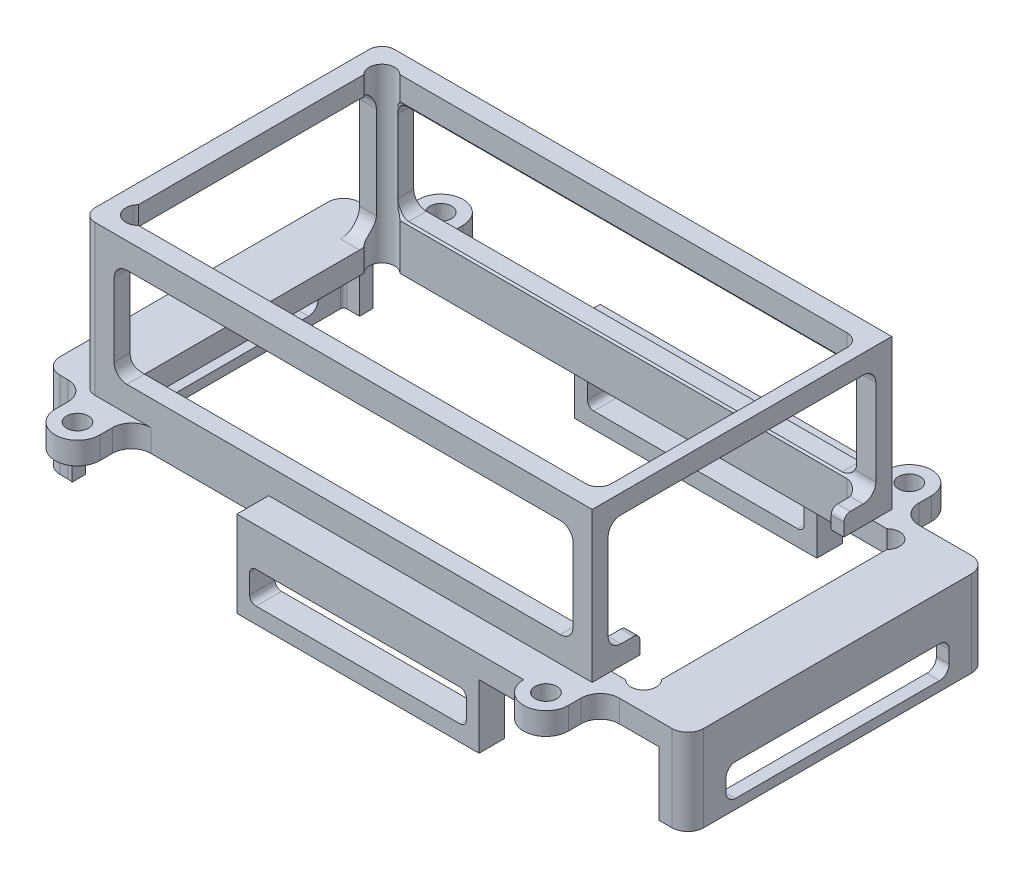
from build123d import *

# Parameters (mm, degrees)
EXTRUDE_1_DEPTH     = 23.5
EXTRUDE_START       = 3.5
SKETCH_2_R          = 1.7
EXTRUDE_2_DEPTH     = 3.5
FILLET_1_R          = 2.5
EXTRUDE_1_2_DEPTH   = 10
CUT_EXTRUDE_1_REACH = 104.962
CUT_EXTRUDE_2_REACH = 83.594
CUT_EXTRUDE_3_REACH = 96.722
CUT_EXTRUDE_4_DEPTH = 3.5
CUT_EXTRUDE_5_REACH = 108.664
SKETCH_9_W          = 45
SKETCH_9_H          = 3.5
EXTRUDE_3_DEPTH     = 5
SKETCH_10_W         = 45
SKETCH_10_H         = 3.5
EXTRUDE_4_DEPTH     = 5
SKETCH_11_W         = 38
SKETCH_11_H         = 4
EXTRUDE_5_DEPTH     = 10
CUT_EXTRUDE_6_REACH = 87.073
FILLET_3_R          = 3


with BuildPart() as part:
    # 草图1 → Extrude 1 (new body)
    with BuildSketch(Plane(origin=(0, 0, 0), x_dir=(1, 0, 0), z_dir=(0, 1, 0))):
        with BuildLine():
            Line((-38, 23.5), (40, 23.5))
            Line((40, 23.5), (40, -23.5))
            Line((40, -23.5), (-38, -23.5))
            ThreePointArc((-38, -23.5), (-39.414213562, -22.914213562), (-40, -21.5))
            Line((-40, -21.5), (-40, 21.5))
            ThreePointArc((-40, 21.5), (-39.414213562, 22.914213562), (-38, 23.5))
        make_face()
        with BuildLine():
            Line((-34.171572875, -20.5), (36, -20.5))
            ThreePointArc((36, -20.5), (37.414213562, -19.914213562), (38, -18.5))
            Line((38, -18.5), (38, 18.5))
            ThreePointArc((38, 18.5), (37.414213562, 19.914213562), (36, 20.5))
            Line((36, 20.5), (-34.171572875, 20.5))
            ThreePointArc((-34.171572875, 20.5), (-37, 20.5), (-37, 17.671572875))
            Line((-37, 17.671572875), (-37, -17.671572875))
            ThreePointArc((-37, -17.671572875), (-37, -20.5), (-34.171572875, -20.5))
        make_face(mode=Mode.SUBTRACT)
    extrude(amount=EXTRUDE_1_DEPTH)

    # 草图2 → 凸台-拉伸2 (add)
    with BuildSketch(Plane.XZ.offset(EXTRUDE_START)):
        with BuildLine():
            Line((55, 0), (55, 23.5))
            Line((55, 23.5), (41.25, 23.5))
            Line((41.25, 23.5), (41.25, 28.5))
            ThreePointArc((41.25, 28.5), (37.75, 32), (34.25, 28.5))
            Line((34.25, 28.5), (34.25, 23.5))
            Line((34.25, 23.5), (-32.25, 23.5))
            Line((-32.25, 23.5), (-32.25, 28.5))
            ThreePointArc((-32.25, 28.5), (-35.75, 32), (-39.25, 28.5))
            Line((-39.25, 28.5), (-39.25, 23.5))
            Line((-39.25, 23.5), (-46, 23.5))
            Line((-46, 23.5), (-46, -23.5))
            Line((-46, -23.5), (-39.25, -23.5))
            Line((-39.25, -23.5), (-39.25, -28.5))
            ThreePointArc((-39.25, -28.5), (-35.75, -32), (-32.25, -28.5))
            Line((-32.25, -28.5), (-32.25, -23.5))
            Line((-32.25, -23.5), (34.25, -23.5))
            Line((34.25, -23.5), (34.25, -28.5))
            ThreePointArc((34.25, -28.5), (37.75, -32), (41.25, -28.5))
            Line((41.25, -28.5), (41.25, -23.5))
            Line((41.25, -23.5), (55, -23.5))
            Line((55, -23.5), (55, 0))
        make_face()
        with Locations(Location((37.75, 28.5, 0), (0, 0, 270))):
            Circle(SKETCH_2_R, mode=Mode.SUBTRACT)
        with Locations(Location((37.75, -28.5, 0), (0, 0, 90))):
            Circle(SKETCH_2_R, mode=Mode.SUBTRACT)
        with Locations(Location((-35.75, -28.5, 0), (0, 0, 270))):
            Circle(SKETCH_2_R, mode=Mode.SUBTRACT)
        with Locations(Location((-35.75, 28.5, 0), (0, 0, 90))):
            Circle(SKETCH_2_R, mode=Mode.SUBTRACT)
        with BuildLine():
            Line((-34.171572875, 20.5), (42.231907087, 20.5))
            ThreePointArc((42.231907087, 20.5), (45.060334211, 20.5), (45.060334211, 17.671572875))
            Line((45.060334211, 17.671572875), (45.060334211, -17.671572875))
            ThreePointArc((45.060334211, -17.671572875), (45.060334211, -20.5), (42.231907087, -20.5))
            Line((42.231907087, -20.5), (-34.171572875, -20.5))
            ThreePointArc((-34.171572875, -20.5), (-37, -20.5), (-37, -17.671572875))
            Line((-37, -17.671572875), (-37, 17.671572875))
            ThreePointArc((-37, 17.671572875), (-37, 20.5), (-34.171572875, 20.5))
        make_face(mode=Mode.SUBTRACT)
    extrude(amount=-EXTRUDE_2_DEPTH)

    # 圆角1
    fillet_1_edges = [part.edges().sort_by_distance(p)[0] for p in [
        (55, -1.75, -23.5),
        (55, -1.75, 23.5),
        (-46, -1.75, 23.5),
        (-46, -1.75, -23.5),
    ]]
    fillet(fillet_1_edges, radius=FILLET_1_R)

    # 草图3 → Extrude 1 2 (add)
    with BuildSketch(Plane.XZ.offset(3.5)):
        with BuildLine():
            Line((50.5, -23.5), (52.5, -23.5))
            ThreePointArc((52.5, -23.5), (54.267766953, -22.767766953), (55, -21))
            Line((55, -21), (55, 21))
            ThreePointArc((55, 21), (54.267766953, 22.767766953), (52.5, 23.5))
            Line((52.5, 23.5), (50.5, 23.5))
            Line((50.5, 23.5), (50.5, 21.5))
            Line((50.5, 21.5), (52.5, 21.5))
            ThreePointArc((52.5, 21.5), (52.853553391, 21.353553391), (53, 21))
            Line((53, 21), (53, -21))
            ThreePointArc((53, -21), (52.853553391, -21.353553391), (52.5, -21.5))
            Line((52.5, -21.5), (50.5, -21.5))
            Line((50.5, -21.5), (50.5, -23.5))
        make_face()
        with BuildLine():
            Line((-41.5, 23.5), (-43.5, 23.5))
            ThreePointArc((-43.5, 23.5), (-45.267766953, 22.767766953), (-46, 21))
            Line((-46, 21), (-46, -21))
            ThreePointArc((-46, -21), (-45.267766953, -22.767766953), (-43.5, -23.5))
            Line((-43.5, -23.5), (-41.5, -23.5))
            Line((-41.5, -23.5), (-41.5, -21.5))
            Line((-41.5, -21.5), (-43.5, -21.5))
            ThreePointArc((-43.5, -21.5), (-43.853553391, -21.353553391), (-44, -21))
            Line((-44, -21), (-44, 21))
            ThreePointArc((-44, 21), (-43.853553391, 21.353553391), (-43.5, 21.5))
            Line((-43.5, 21.5), (-41.5, 21.5))
            Line((-41.5, 21.5), (-41.5, 23.5))
        make_face()
    extrude(amount=EXTRUDE_1_2_DEPTH)

    # 草图4 → 切除-拉伸1 (cut, up to next)
    with BuildSketch(Plane.ZY.offset(40), mode=Mode.PRIVATE) as cut_extrude_1_sk1:
        with BuildLine():
            Line((17, 0), (-17, 0))
            ThreePointArc((-17, 0), (-19.121320344, 0.878679656), (-20, 3))
            Line((-20, 3), (-20, 17.5))
            ThreePointArc((-20, 17.5), (-19.121320344, 19.621320344), (-17, 20.5))
            Line((-17, 20.5), (17, 20.5))
            ThreePointArc((17, 20.5), (19.121320344, 19.621320344), (20, 17.5))
            Line((20, 17.5), (20, 3))
            ThreePointArc((20, 3), (19.121320344, 0.878679656), (17, 0))
        make_face()
    cut_extrude_1_tool1 = extrude(cut_extrude_1_sk1.sketch, amount=-CUT_EXTRUDE_1_REACH, mode=Mode.PRIVATE) & part.part
    add(cut_extrude_1_tool1.solids().sort_by_distance((-40, 10.25, 0))[0], mode=Mode.SUBTRACT)

    # 切除-拉伸2: up to this face of the body (flat: up to its plane)
    cut_extrude_2_end = Plane(part.part.faces().sort_by_distance((1, 10.228942273, 23.5))[0])
    # 草图5 → 切除-拉伸2 (cut, up to the picked face)
    with BuildSketch(Plane(origin=(0, 0, -23.5), x_dir=(-1, 0, 0), z_dir=(0, 0, -1)), mode=Mode.PRIVATE) as cut_extrude_2_sk1:
        with BuildLine():
            Line((-37, 11.75), (-37, 17.5))
            ThreePointArc((-37, 17.5), (-36.414213562, 18.914213562), (-35, 19.5))
            Line((-35, 19.5), (33, 19.5))
            ThreePointArc((33, 19.5), (34.414213562, 18.914213562), (35, 17.5))
            Line((35, 17.5), (35, 6))
            ThreePointArc((35, 6), (34.414213562, 4.585786438), (33, 4))
            Line((33, 4), (-35, 4))
            ThreePointArc((-35, 4), (-36.414213562, 4.585786438), (-37, 6))
            Line((-37, 6), (-37, 11.75))
        make_face()
    cut_extrude_2_tool1 = split(extrude(cut_extrude_2_sk1.sketch, amount=-CUT_EXTRUDE_2_REACH, mode=Mode.PRIVATE), bisect_by=cut_extrude_2_end, keep=Keep.BOTH, mode=Mode.PRIVATE)
    add(cut_extrude_2_tool1.solids().sort_by(Axis((1, 11.75, -23.5), (0, 0, 1)))[0], mode=Mode.SUBTRACT)

    # 草图6 → 切除-拉伸3 (cut, up to next)
    with BuildSketch(Plane(origin=(40, 0, 0), x_dir=(0, 0, -1), z_dir=(1, 0, 0)), mode=Mode.PRIVATE) as cut_extrude_3_sk1:
        with BuildLine():
            Line((21, 5), (21, 18.5))
            ThreePointArc((21, 18.5), (20.414213562, 19.914213562), (19, 20.5))
            Line((19, 20.5), (-19, 20.5))
            ThreePointArc((-19, 20.5), (-20.414213562, 19.914213562), (-21, 18.5))
            Line((-21, 18.5), (-21, 5))
            ThreePointArc((-21, 5), (-20.414213562, 3.585786438), (-19, 3))
            Line((-19, 3), (-17, 3))
            ThreePointArc((-17, 3), (-16.292893219, 2.707106781), (-16, 2))
            Line((-16, 2), (-16, 0))
            Line((-16, 0), (16, 0))
            Line((16, 0), (16, 2))
            ThreePointArc((16, 2), (16.292893219, 2.707106781), (17, 3))
            Line((17, 3), (19, 3))
            ThreePointArc((19, 3), (20.414213562, 3.585786438), (21, 5))
        make_face()
    cut_extrude_3_tool1 = extrude(cut_extrude_3_sk1.sketch, amount=-CUT_EXTRUDE_3_REACH, mode=Mode.PRIVATE) & part.part
    add(cut_extrude_3_tool1.solids().sort_by_distance((40, 10.556936, 0))[0], mode=Mode.SUBTRACT)

    # 草图7 → 切除-拉伸4 (cut)
    with BuildSketch(Plane.ZY.offset(-53)):
        with BuildLine():
            Line((16, -12), (-16, -12))
            ThreePointArc((-16, -12), (-17.060660172, -11.560660172), (-17.5, -10.5))
            Line((-17.5, -10.5), (-17.5, -8.5))
            ThreePointArc((-17.5, -8.5), (-17.060660172, -7.439339828), (-16, -7))
            Line((-16, -7), (16, -7))
            ThreePointArc((16, -7), (17.060660172, -7.439339828), (17.5, -8.5))
            Line((17.5, -8.5), (17.5, -10.5))
            ThreePointArc((17.5, -10.5), (17.060660172, -11.560660172), (16, -12))
        make_face()
    extrude(amount=-CUT_EXTRUDE_4_DEPTH, mode=Mode.SUBTRACT)

    # 草图8 → 切除-拉伸5 (cut, up to next)
    with BuildSketch(Plane(origin=(-44, 0, 0), x_dir=(0, 0, -1), z_dir=(1, 0, 0)), mode=Mode.PRIVATE) as cut_extrude_5_sk1:
        with BuildLine():
            Line((16, -12), (-16, -12))
            ThreePointArc((-16, -12), (-17.060660172, -11.560660172), (-17.5, -10.5))
            Line((-17.5, -10.5), (-17.5, -8.5))
            ThreePointArc((-17.5, -8.5), (-17.060660172, -7.439339828), (-16, -7))
            Line((-16, -7), (16, -7))
            ThreePointArc((16, -7), (17.060660172, -7.439339828), (17.5, -8.5))
            Line((17.5, -8.5), (17.5, -10.5))
            ThreePointArc((17.5, -10.5), (17.060660172, -11.560660172), (16, -12))
        make_face()
    cut_extrude_5_tool1 = extrude(cut_extrude_5_sk1.sketch, amount=-CUT_EXTRUDE_5_REACH, mode=Mode.PRIVATE) & part.part
    add(cut_extrude_5_tool1.solids().sort_by_distance((-44, -9.5, 0))[0], mode=Mode.SUBTRACT)

    # 草图9 → 凸台-拉伸3 (add)
    with BuildSketch(Plane.XY.offset(23.5)):
        with Locations((11.75, -1.75)):
            Rectangle(SKETCH_9_W, SKETCH_9_H)
    extrude(amount=EXTRUDE_3_DEPTH)

    # 草图10 → 凸台-拉伸4 (add)
    with BuildSketch(Plane(origin=(0, 0, -23.5), x_dir=(-1, 0, 0), z_dir=(0, 0, -1))):
        with Locations((-11.75, -1.75)):
            Rectangle(SKETCH_10_W, SKETCH_10_H)
    extrude(amount=EXTRUDE_4_DEPTH)

    # 草图11 → 凸台-拉伸5 (add)
    with BuildSketch(Plane.XZ.offset(3.5)):
        with Locations((8.25, -26.5)):
            Rectangle(SKETCH_11_W, SKETCH_11_H)
        with Locations((8.25, 26.5)):
            Rectangle(SKETCH_11_W, SKETCH_11_H)
    extrude(amount=EXTRUDE_5_DEPTH)

    # 切除-拉伸6: up to this face of the body (flat: up to its plane)
    cut_extrude_6_end = Plane(part.part.faces().sort_by_distance((9.275581395, -6.522093023, -28.5))[0])
    # 草图12 → 切除-拉伸6 (cut, up to the picked face)
    with BuildSketch(Plane.XY.offset(28.5), mode=Mode.PRIVATE) as cut_extrude_6_sk1:
        with BuildLine():
            Line((24.25, -11), (-7.75, -11))
            ThreePointArc((-7.75, -11), (-8.457106781, -10.707106781), (-8.75, -10))
            Line((-8.75, -10), (-8.75, -7))
            ThreePointArc((-8.75, -7), (-8.457106781, -6.292893219), (-7.75, -6))
            Line((-7.75, -6), (24.25, -6))
            ThreePointArc((24.25, -6), (24.957106781, -6.292893219), (25.25, -7))
            Line((25.25, -7), (25.25, -10))
            ThreePointArc((25.25, -10), (24.957106781, -10.707106781), (24.25, -11))
        make_face()
    cut_extrude_6_tool1 = split(extrude(cut_extrude_6_sk1.sketch, amount=-CUT_EXTRUDE_6_REACH, mode=Mode.PRIVATE), bisect_by=cut_extrude_6_end, keep=Keep.BOTH, mode=Mode.PRIVATE)
    add(cut_extrude_6_tool1.solids().sort_by(Axis((8.25, -8.5, 28.5), (0, 0, -1)))[0], mode=Mode.SUBTRACT)

    # 圆角3
    fillet_3_edges = [part.edges().sort_by_distance(p)[0] for p in [
        (-39.25, -1.75, 23.5),
        (-32.25, -1.75, 23.5),
        (41.25, -1.75, 23.5),
        (41.25, -1.75, -23.5),
        (-39.25, -1.75, -23.5),
        (-32.25, -1.75, -23.5),
    ]]
    fillet(fillet_3_edges, radius=FILLET_3_R)


solid = part.part
